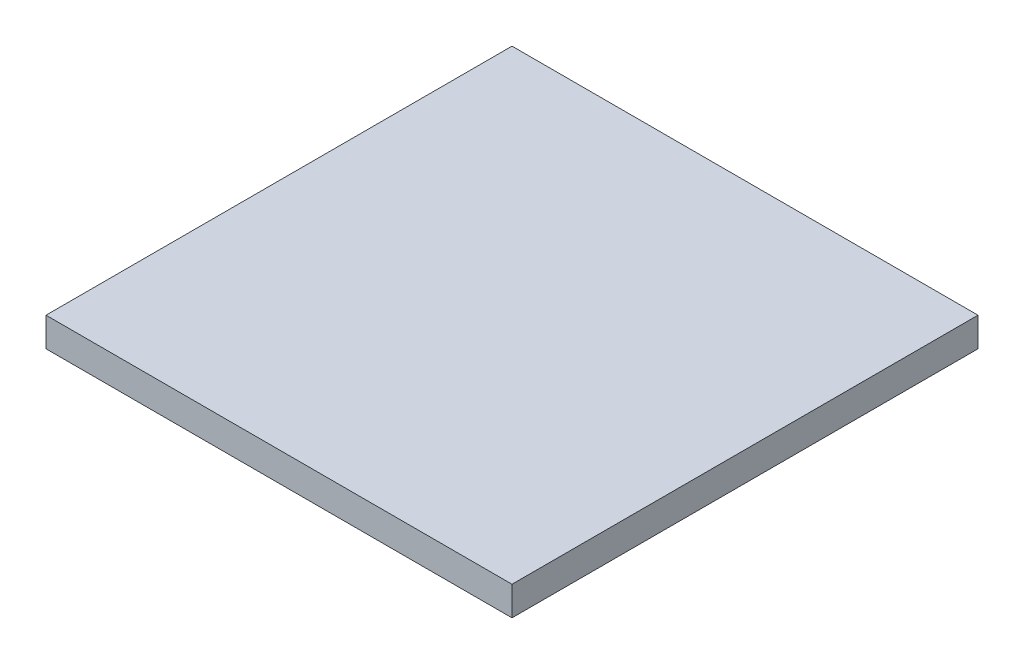
from build123d import *

# Parameters (mm, degrees)
SKETCH1_W           = 203.2
SKETCH1_H           = 203.2
BOSS_EXTRUDE1_DEPTH = 12.7


with BuildPart() as part:
    # Sketch1 → Boss-Extrude1 (new body)
    with BuildSketch(Plane(origin=(0, 0, 0), x_dir=(1, 0, 0), z_dir=(0, 1, 0))):
        Rectangle(SKETCH1_W, SKETCH1_H)
    extrude(amount=BOSS_EXTRUDE1_DEPTH)


solid = part.part
